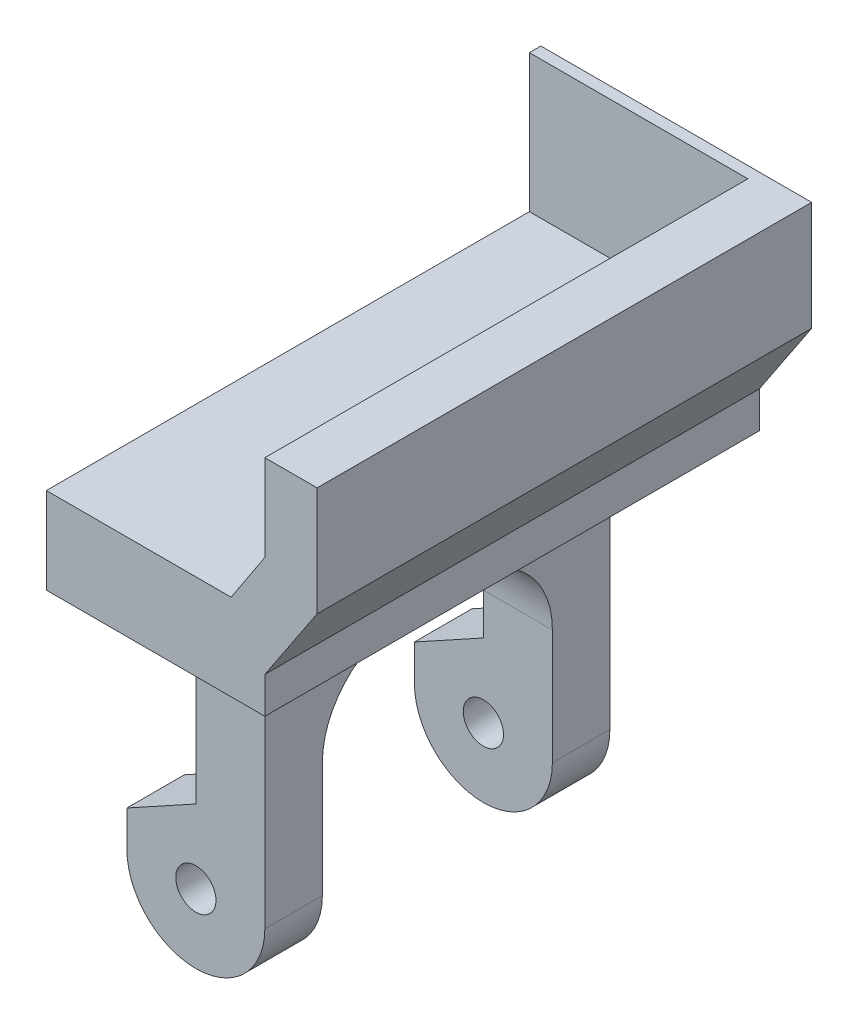
from build123d import *

# Parameters (mm, degrees)
ESQUISSE1_R        = 3.5
BOSS_EXTRU_1_DEPTH = 10
BOSS_EXTRU_2_DEPTH = 5
ESQUISSE3_W        = 12
ESQUISSE3_H        = 40
BOSS_EXTRU_3_DEPTH = 5
CONG_1_R           = 15
ESQUISSE4_W        = 38
ESQUISSE4_H        = 86
BOSS_EXTRU_4_DEPTH = 15
BOSS_EXTRU_5_DEPTH = 85
BOSS_EXTRU_6_DEPTH = 2


with BuildPart() as part:
    # Esquisse1 → Boss.-Extru.1 (new body)
    with BuildSketch(Plane.XY):
        with BuildLine():
            Line((-12, 0), (-12, 6.188999999))
            Line((-12, 6.188999999), (0, 12.795952069))
            Line((0, 12.795952069), (0, 40))
            Line((0, 40), (12, 40))
            Line((12, 40), (12, 0))
            ThreePointArc((12, 0), (0, -12), (-12, 0))
        make_face()
        Circle(ESQUISSE1_R, mode=Mode.SUBTRACT)
    extrude(amount=BOSS_EXTRU_1_DEPTH)


with BuildPart() as body_2:
    # Esquisse2 → Boss.-Extru.2 (new body)
    with BuildSketch(Plane(origin=(0, 40, 0), x_dir=(1, 0, 0), z_dir=(0, 1, 0))):
        Polygon((0, -10), (0, -60), (12, -60), (12, -10), (12, 0), (0, 0), align=None)
    extrude(amount=BOSS_EXTRU_2_DEPTH)


with BuildPart() as body_3:
    # Symétrie2: mirrored copy
    add(part.part.mirror(Plane.XY.offset(30)))

    # Combiner1: union body 2, part
    add(body_2.part)
    add(part.part)

    # Esquisse3 → Boss.-Extru.3 (add)
    with BuildSketch(Plane.XZ.offset(-40)):
        with Locations((6, 30)):
            Rectangle(ESQUISSE3_W, ESQUISSE3_H)
    extrude(amount=BOSS_EXTRU_3_DEPTH)

    # Congé1
    cong_1_edges = [body_3.edges().sort_by_distance(p)[0] for p in [
        (6, 35, 10),
        (6, 35, 50),
    ]]
    fillet(cong_1_edges, radius=CONG_1_R)

    # Esquisse4 → Boss.-Extru.4 (add)
    with BuildSketch(Plane(origin=(0, 45, 0), x_dir=(1, 0, 0), z_dir=(0, 1, 0))):
        with Locations((6, -30)):
            Rectangle(ESQUISSE4_W, ESQUISSE4_H)
    extrude(amount=BOSS_EXTRU_4_DEPTH)

    # Esquisse5 → Boss.-Extru.5 (add)
    with BuildSketch(Plane.XY.offset(73)):
        Polygon((25, 51.312184347), (34.08898267, 64.966903238), (34.08898267, 83.946962496), (25, 83.946962496), (25, 68.926771716), (19.136954754, 60), align=None)
    extrude(amount=-BOSS_EXTRU_5_DEPTH)

    # Esquisse6 → Boss.-Extru.6 (add)
    with BuildSketch(Plane(origin=(0, 0, -13), x_dir=(-1, 0, 0), z_dir=(0, 0, -1))):
        Polygon((-34.08898267, 64.966903238), (-25, 51.312184347), (-25, 45), (13, 45), (13, 60), (13, 83.946962496), (-25, 83.946962496), (-34.08898267, 83.946962496), align=None)
    extrude(amount=-BOSS_EXTRU_6_DEPTH)


solid = body_3.part
